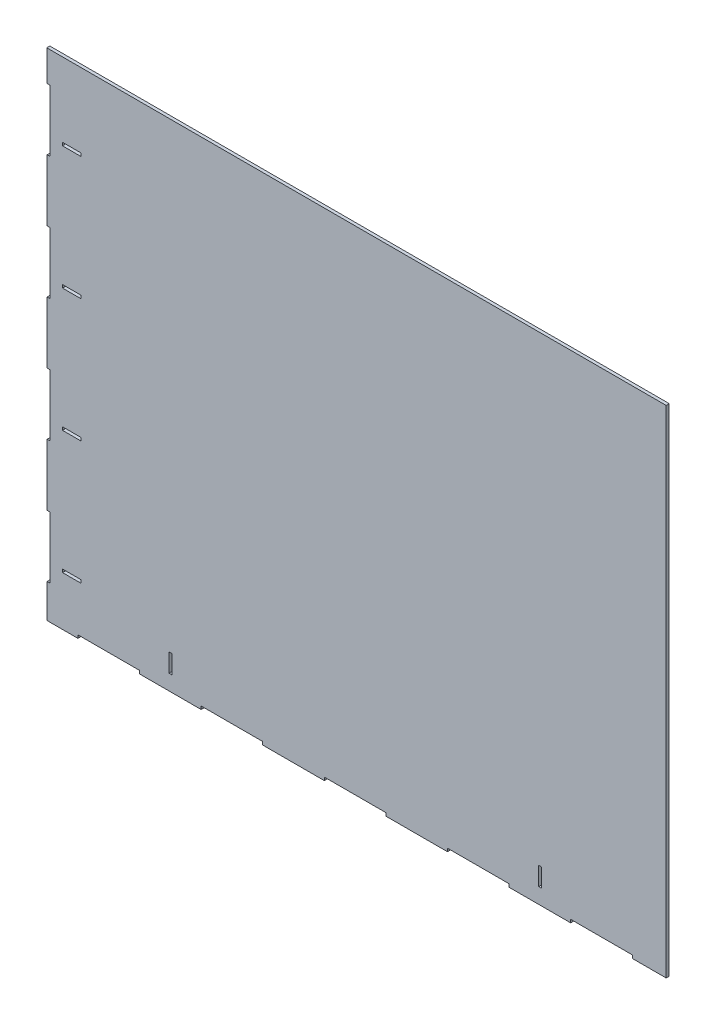
from build123d import *

# Parameters (mm, degrees)
SKETCH1_W           = 15
SKETCH1_H           = 2.5
SKETCH1_W_2         = 2.5
SKETCH1_H_2         = 15
BOSS_EXTRUDE1_DEPTH = 2.5


with BuildPart() as part:
    # Sketch1 → Boss-Extrude1 (new body)
    with BuildSketch(Plane.XY):
        Polygon((-178.831793337, 153.336874277), (298.668206663, 153.336874277), (298.668206663, 135.823489403), (298.668206663, -229.176510597), (298.668206663, -249.18989547), (271.168206663, -249.18989547), (271.168206662, -246.68989547), (221.168206662, -246.68989547), (221.168206662, -249.18989547), (171.168206662, -249.18989547), (171.168206662, -246.68989547), (121.168206662, -246.68989547), (121.168206662, -249.18989547), (71.168206663, -249.18989547), (71.168206663, -246.68989547), (21.168206663, -246.68989547), (21.168206663, -249.18989547), (-28.831793337, -249.18989547), (-28.831793337, -246.68989547), (-78.831793337, -246.68989547), (-78.831793337, -249.18989547), (-128.831793337, -249.18989547), (-128.831793337, -246.68989547), (-178.831793337, -246.68989547), (-178.831793337, -249.18989547), (-201.331793337, -249.18989547), (-203.831793337, -249.18989547), (-203.831793337, -221.68989547), (-201.331793337, -221.68989547), (-201.331793337, -171.68989547), (-203.831793337, -171.68989547), (-203.831793337, -121.68989547), (-201.331793337, -121.68989547), (-201.331793337, -71.68989547), (-203.831793337, -71.68989547), (-203.831793337, -21.68989547), (-201.331793337, -21.68989547), (-201.331793337, 28.31010453), (-203.831793337, 28.31010453), (-203.831793337, 78.31010453), (-201.331793337, 78.31010453), (-201.331793337, 128.336874277), (-204.108332232, 128.336874277), (-204.108332232, 153.336874277), (-201.718717054, 153.336874277), align=None)
        with Locations((-183.831793337, -107.93989547)):
            Rectangle(SKETCH1_W, SKETCH1_H, mode=Mode.SUBTRACT)
        with Locations((-183.831793337, -207.93989547)):
            Rectangle(SKETCH1_W, SKETCH1_H, mode=Mode.SUBTRACT)
        with Locations((-183.831793337, -7.93989547)):
            Rectangle(SKETCH1_W, SKETCH1_H, mode=Mode.SUBTRACT)
        with Locations((-183.831793337, 92.06010453)):
            Rectangle(SKETCH1_W, SKETCH1_H, mode=Mode.SUBTRACT)
        with Locations((-103.581793337, -229.18989547)):
            Rectangle(SKETCH1_W_2, SKETCH1_H_2, mode=Mode.SUBTRACT)
        with Locations((196.418206663, -229.18989547)):
            Rectangle(SKETCH1_W_2, SKETCH1_H_2, mode=Mode.SUBTRACT)
    extrude(amount=BOSS_EXTRUDE1_DEPTH)


solid = part.part
